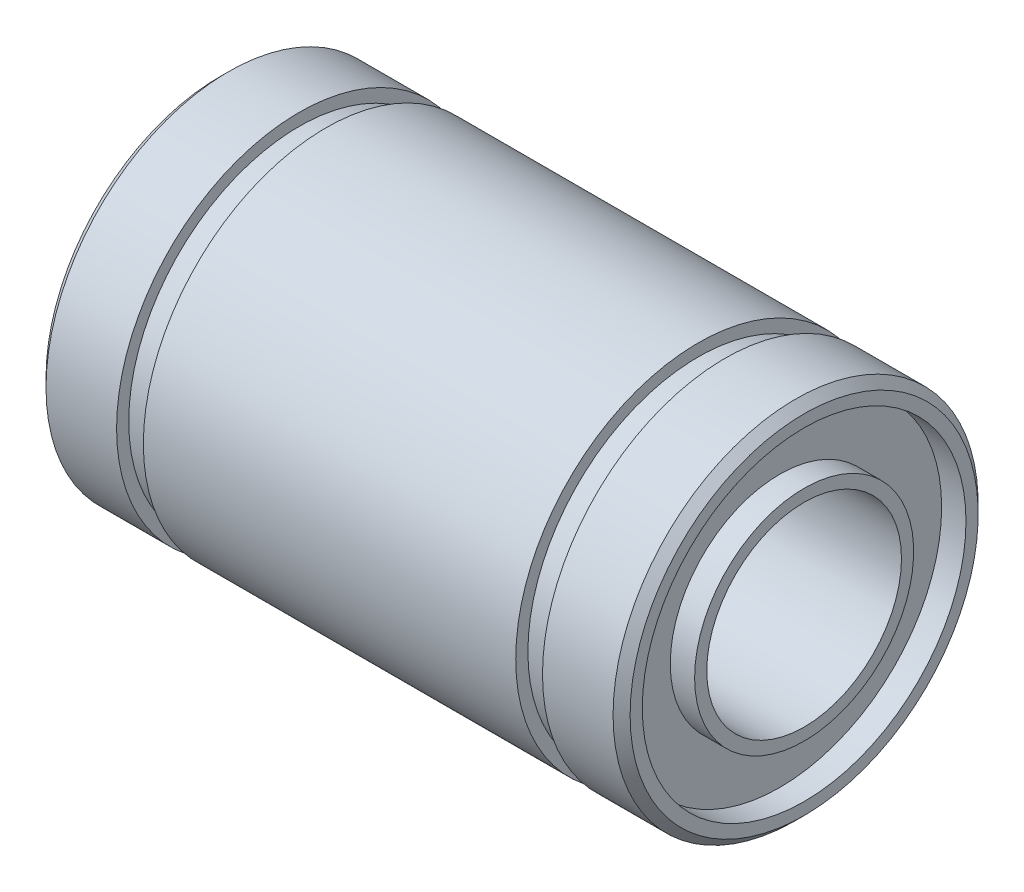
from build123d import *


with BuildPart() as part:
    # Sketch1 → Revolve1 (revolve)
    with BuildSketch(Plane.XY, mode=Mode.PRIVATE) as revolve1_sk:
        Polygon((11.65, 7.5), (12, 7.15), (12, 6.65), (11, 6.65), (11, 4.5), (12, 4.5), (12, 4), (-12, 4), (-12, 4.5), (-11, 4.5), (-11, 6.65), (-12, 6.65), (-12, 7.15), (-11.65, 7.5), (-8.75, 7.5), (-8.75, 7), (-7.65, 7), (-7.65, 7.5), (7.65, 7.5), (7.65, 7), (8.75, 7), (8.75, 7.5), align=None)
    revolve(revolve1_sk.sketch.rotate(Axis((-45.689505325, 0, 0), (1, 0, 0)), 90), axis=Axis((-45.689505325, 0, 0), (1, 0, 0)))


solid = part.part
